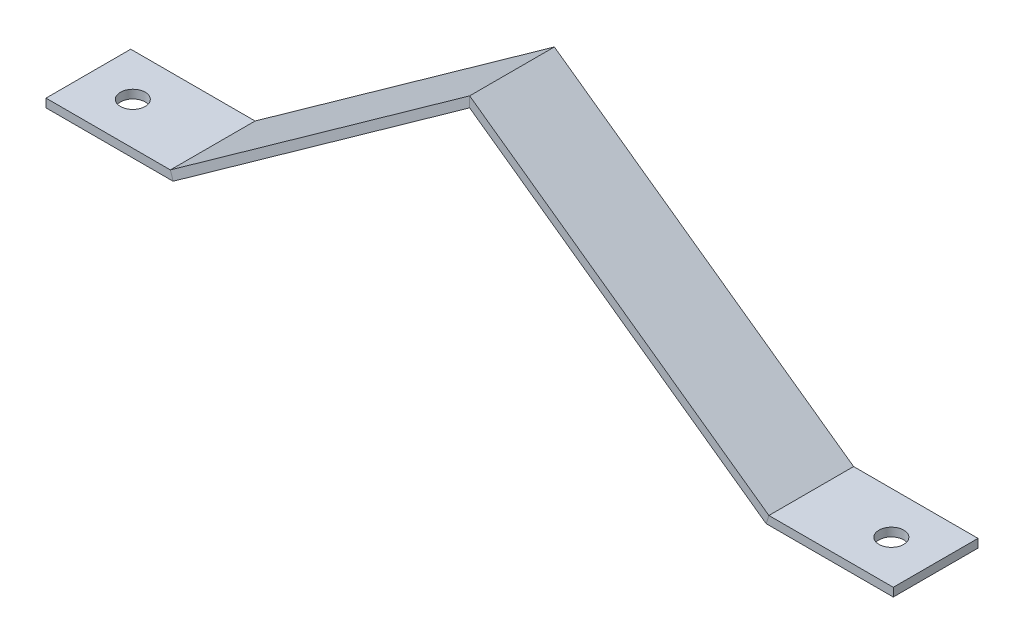
from build123d import *

# Parameters (mm, degrees)
SKETCH3_W                    = 2.54
SKETCH3_H                    = 0.254
F_69_0_0292_DIAMETER_HOLE1_D = 0.74168


with BuildPart() as part:
    # Sweep1: sweep along a path in Sketch2
    with BuildLine(Plane.XY) as sweep1_path:
        Line((0, 0), (-3.81, 0))
        Line((-3.81, 0), (-12.7, 6.35))
        Line((-12.7, 6.35), (-21.59, 0))
        Line((-21.59, 0), (-25.4, 0))
    # Sketch3 → Sweep1 (sweep)
    with BuildSketch(Plane(origin=(0, 0, 0), x_dir=(0, 0, -1), z_dir=(1, 0, 0))):
        with Locations((1.27, 0.127)):
            Rectangle(SKETCH3_W, SKETCH3_H)
    sweep(path=sweep1_path.line, transition=Transition.RIGHT)

    # #69 (0.0292) Diameter Hole1 (through all)
    with Locations(Plane(origin=(0, 0.254, 0), x_dir=(1, 0, 0), z_dir=(0, 1, 0))):
        with Locations((-24.0665, 1.27), (-1.3271754, 1.27)):
            Hole(F_69_0_0292_DIAMETER_HOLE1_D / 2)


solid = part.part
